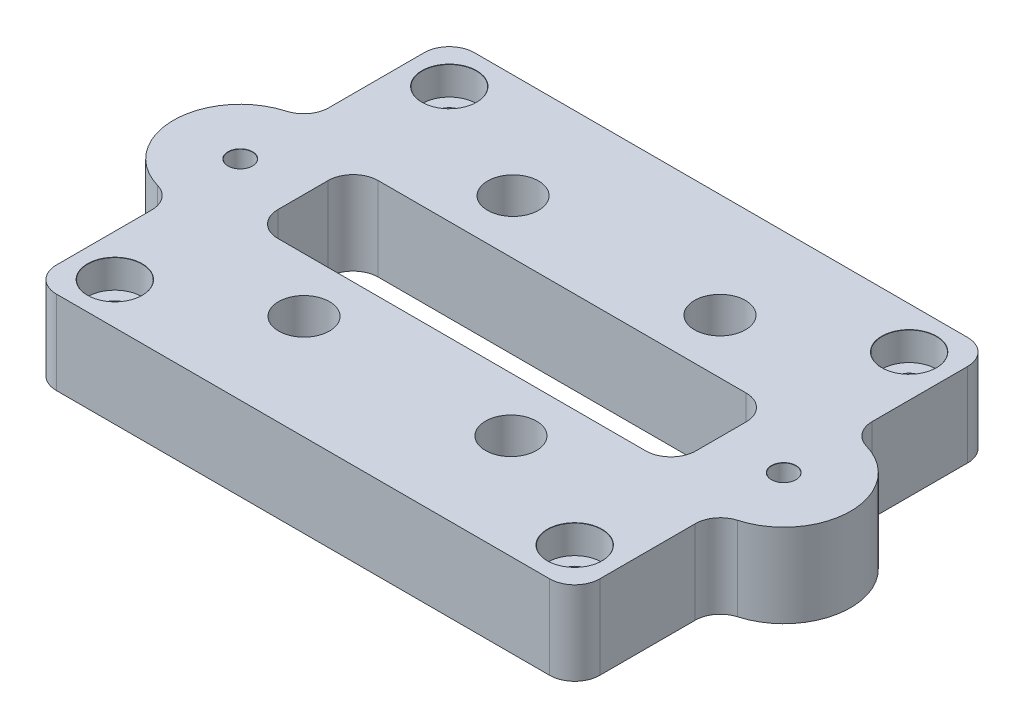
from build123d import *

# Parameters (mm, degrees)
SKETCH1_W                                    = 65
SKETCH1_H                                    = 50
SKETCH1_R                                    = 3.05
BOSS_EXTRUDE1_DEPTH                          = 10
FILLET1_R                                    = 3
CBORE_FOR_M3_HEX_SOCKET_HEAD_CAP_SCR_2_COUNT = 2
CBORE_FOR_M3_HEX_SOCKET_HEAD_CAP_SCR_2_PITCH = 55
CBORE_FOR_M3_HEX_SOCKET_HEAD_CAP_SCR_3_COUNT = 2
CBORE_FOR_M3_HEX_SOCKET_HEAD_CAP_SCR_3_PITCH = 68.007352544
CBORE_FOR_M3_HEX_SOCKET_HEAD_CAP_SCR_4_COUNT = 2
CBORE_FOR_M3_HEX_SOCKET_HEAD_CAP_SCR_4_PITCH = 40
SKETCH6_R                                    = 8
BOSS_EXTRUDE2_DEPTH                          = 10
FILLET2_R                                    = 3
F_2_9_2_9_DIAMETER_HOLE1_D                   = 2.9
F_2_9_2_9_DIAMETER_HOLE1_DEPTH               = 6
F_2_9_2_9_DIAMETER_HOLE1_CSINK_D             = 2.95
F_2_9_2_9_DIAMETER_HOLE1_CSINK_ANGLE         = 90
F_2_9_2_9_DIAMETER_HOLE1_TIP                 = 0.871247898
CUT_EXTRUDE1_DEPTH                           = 10


with BuildPart() as part:
    # Sketch1 → Boss-Extrude1 (new body)
    with BuildSketch(Plane(origin=(0, 0, 0), x_dir=(1, 0, 0), z_dir=(0, 1, 0))):
        Rectangle(SKETCH1_W, SKETCH1_H)
        with Locations(Location((-12.375, 12.5, 0), (0, 0, 270))):
            Circle(SKETCH1_R, mode=Mode.SUBTRACT)
        with Locations(Location((-12.375, -12.5, 0), (0, 0, 270))):
            Circle(SKETCH1_R, mode=Mode.SUBTRACT)
        with Locations(Location((12.375, 12.5, 0), (0, 0, 270))):
            Circle(SKETCH1_R, mode=Mode.SUBTRACT)
        with Locations(Location((12.375, -12.5, 0), (0, 0, 270))):
            Circle(SKETCH1_R, mode=Mode.SUBTRACT)
    extrude(amount=BOSS_EXTRUDE1_DEPTH)

    # Fillet1
    fillet1_edges = [part.edges().sort_by_distance(p)[0] for p in [
        (32.5, 5, 25),
        (-32.5, 5, 25),
        (-32.5, 5, -25),
        (32.5, 5, -25),
    ]]
    fillet(fillet1_edges, radius=FILLET1_R)

    # Sketch3 → CBORE for M3 Hex Socket Head Cap Screw1 (revolve, cut)
    with BuildSketch(Plane(origin=(27.5, 10, -20), x_dir=(0, 0, 1), z_dir=(1, 0, 0))):
        Polygon((0, 0), (0, 10), (1.7, 10), (1.7, 3.4), (3.25, 3.4), (3.25, 0.025), (3.275, 0), align=None)
    cbore_for_m3_hex_socket_head_cap_screw1 = revolve(axis=Axis((27.5, 16.35, -20), (0, -1, 0)), mode=Mode.SUBTRACT)

    # CBORE for M3 Hex Socket Head Cap Scr 2: CBORE for M3 Hex Socket Head Cap Screw1 ×2
    with Locations(*[(-i * CBORE_FOR_M3_HEX_SOCKET_HEAD_CAP_SCR_2_PITCH, 0, 0) for i in range(1, CBORE_FOR_M3_HEX_SOCKET_HEAD_CAP_SCR_2_COUNT)]):
        add(cbore_for_m3_hex_socket_head_cap_screw1, mode=Mode.SUBTRACT)

    # CBORE for M3 Hex Socket Head Cap Scr 3: CBORE for M3 Hex Socket Head Cap Screw1 ×2
    with Locations(*[Vector(-0.8087360843031886, 0, 0.5881716976750463) * (i * CBORE_FOR_M3_HEX_SOCKET_HEAD_CAP_SCR_3_PITCH) for i in range(1, CBORE_FOR_M3_HEX_SOCKET_HEAD_CAP_SCR_3_COUNT)]):
        add(cbore_for_m3_hex_socket_head_cap_screw1, mode=Mode.SUBTRACT)

    # CBORE for M3 Hex Socket Head Cap Scr 4: CBORE for M3 Hex Socket Head Cap Screw1 ×2
    with Locations(*[(0, 0, i * CBORE_FOR_M3_HEX_SOCKET_HEAD_CAP_SCR_4_PITCH) for i in range(1, CBORE_FOR_M3_HEX_SOCKET_HEAD_CAP_SCR_4_COUNT)]):
        add(cbore_for_m3_hex_socket_head_cap_screw1, mode=Mode.SUBTRACT)

    # Sketch6 → Boss-Extrude2 (add)
    with BuildSketch(Plane(origin=(0, 10, 0), x_dir=(1, 0, 0), z_dir=(0, 1, 0))):
        with Locations((-32.5, 0)):
            Circle(SKETCH6_R)
        with Locations((32.5, 0)):
            Circle(SKETCH6_R)
    extrude(amount=-BOSS_EXTRUDE2_DEPTH)

    # Fillet2
    fillet2_edges = [part.edges().sort_by_distance(p)[0] for p in [
        (32.5, 5, -8),
        (32.5, 5, 8),
        (-32.5, 5, 8),
        (-32.5, 5, -8),
    ]]
    fillet(fillet2_edges, radius=FILLET2_R)

    # Ø2.9 (2.9) Diameter Hole1
    with Locations(Plane(origin=(0, 10, 0), x_dir=(1, 0, 0), z_dir=(0, 1, 0))):
        with Locations((-32.5, 0), (32.5, 0)):
            CounterSinkHole(F_2_9_2_9_DIAMETER_HOLE1_D / 2, F_2_9_2_9_DIAMETER_HOLE1_CSINK_D / 2, depth=F_2_9_2_9_DIAMETER_HOLE1_DEPTH, counter_sink_angle=F_2_9_2_9_DIAMETER_HOLE1_CSINK_ANGLE)
            with Locations((0, 0, -(F_2_9_2_9_DIAMETER_HOLE1_DEPTH + F_2_9_2_9_DIAMETER_HOLE1_TIP / 2))):  # 118° drill point
                Cone(0, F_2_9_2_9_DIAMETER_HOLE1_D / 2, F_2_9_2_9_DIAMETER_HOLE1_TIP, mode=Mode.SUBTRACT)

    # Sketch9 → Cut-Extrude1 (cut)
    with BuildSketch(Plane(origin=(0, 10, 0), x_dir=(1, 0, 0), z_dir=(0, 1, 0))):
        with BuildLine():
            Line((-22, 6), (22, 6))
            ThreePointArc((22, 6), (24.121320344, 5.121320344), (25, 3))
            Line((25, 3), (25, -3))
            ThreePointArc((25, -3), (24.121320344, -5.121320344), (22, -6))
            Line((22, -6), (-22, -6))
            ThreePointArc((-22, -6), (-24.121320344, -5.121320344), (-25, -3))
            Line((-25, -3), (-25, 3))
            ThreePointArc((-25, 3), (-24.121320344, 5.121320344), (-22, 6))
        make_face()
    extrude(amount=-CUT_EXTRUDE1_DEPTH, mode=Mode.SUBTRACT)


solid = part.part
